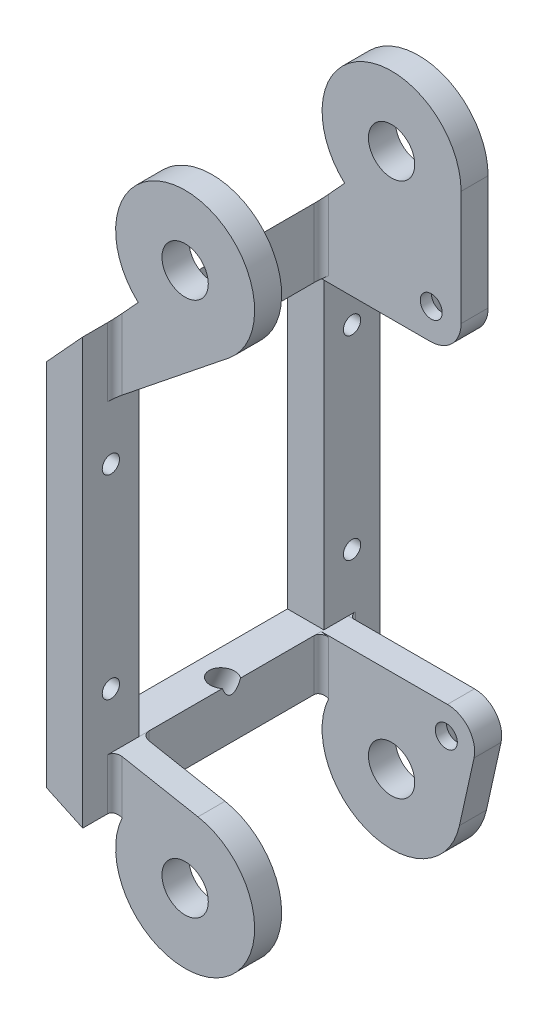
from build123d import *

# Parameters (mm, degrees)
LINK_GEOMETRY_DEPTH                            = 30.572250038
SKETCH3_R                                      = 7.14375
JOINT_ROUNDS_DEPTH                             = 30.572250038
SKETCH5_R                                      = 2.38125
JOINT_HOLES_DEPTH                              = 323.793006671
SKETCH6_W                                      = 19.2375
SKETCH6_H                                      = 31.422524012
BULK_REMOVAL_DEPTH                             = 323.793006671
SKETCH7_W                                      = 19
SKETCH7_H                                      = 31.422524012
CONTACTPAD_OPENING_DEPTH                       = 217.555615914
SKETCH9_R                                      = 7.33425
CUT_EXTRUDE4_DEPTH                             = 3.286125
SKETCH12_W                                     = 53.268009521
SKETCH12_H                                     = 61.768223806
SURFACE_REDUCTION_DEPTH                        = 1.016
F_2_56_TAPPED_HOLE1_D                          = 1.778
F_2_56_TAPPED_HOLE1_CSINK_D                    = 5
F_2_56_TAPPED_HOLE1_CSINK_ANGLE                = 82
SKETCH19_R                                     = 7.33425
CUT_EXTRUDE8_DEPTH                             = 9.221875003
SKETCH20_W                                     = 21.352711571
SKETCH20_H                                     = 18.443750006
CUT_EXTRUDE9_DEPTH                             = 252.802485903
SKETCH21_W                                     = 24.193204712
SKETCH21_H                                     = 71.241054526
CUT_EXTRUDE10_DEPTH                            = 18.427750038
SKETCH22_R                                     = 0.535
CUT_EXTRUDE12_DEPTH                            = 18.427750038
SKETCH23_R                                     = 1.25
CUT_EXTRUDE13_DEPTH                            = 18.427750038
CUT_EXTRUDE14_DEPTH                            = 323.498364807
FILLET1_R                                      = 0.75
BOSS_EXTRUDE1_REACH                            = 320.899
SKETCH28_R                                     = 1.1303
PROX_SPRING_HOLE_DEPTH                         = 2.778125016
FILLET2_R                                      = 2.8
CSK_FOR_2_FLAT_HEAD_MACHINE_SCREW1_D           = 2.2606
CSK_FOR_2_FLAT_HEAD_MACHINE_SCREW1_DEPTH       = 2.777125016
CSK_FOR_2_FLAT_HEAD_MACHINE_SCREW1_CSINK_D     = 5.0999898
CSK_FOR_2_FLAT_HEAD_MACHINE_SCREW1_CSINK_ANGLE = 82
CSK_FOR_2_FLAT_HEAD_MACHINE_SCREW1_TIP         = 0.679152758
SKETCH32_R                                     = 1.025
DISTAL_SHEATH_HOLE_DEPTH                       = 19.05
DISTAL_SHEATH_SLOT_DEPTH                       = 19.05
FILLET3_R                                      = 3.175


with BuildPart() as part:
    # Sketch2 → link_geometry (new body)
    with BuildSketch(Plane.XY):
        Polygon((240.143856424, 163.499556409), (228.143856424, 151.378124535), (216.143856424, 156.973816433), (216.143856424, 193.282422523), (228.143856424, 206.378124535), (240.143856424, 204.262200767), align=None)
    extrude(amount=LINK_GEOMETRY_DEPTH)

    # Sketch3 → joint_rounds (add)
    with BuildSketch(Plane.XY.offset(30.572250038)):
        with Locations((228.143856424, 151.378124535)):
            Circle(SKETCH3_R)
        with Locations((228.143856424, 206.378124535)):
            Circle(SKETCH3_R)
    extrude(amount=-JOINT_ROUNDS_DEPTH)

    # Sketch5 → joint_holes (cut, through all)
    with BuildSketch(Plane.XY.offset(30.572250038)):
        with Locations((228.143856424, 206.378124535)):
            Circle(SKETCH5_R)
        with Locations((228.143856424, 151.378124535)):
            Circle(SKETCH5_R)
    extrude(amount=-JOINT_HOLES_DEPTH, mode=Mode.SUBTRACT)

    # Sketch6 → bulk_removal (cut, through all)
    with BuildSketch(Plane.XY.offset(30.572250038)):
        with Locations((230.525106424, 175.719125556)):
            Rectangle(SKETCH6_W, SKETCH6_H)
    extrude(amount=-BULK_REMOVAL_DEPTH, mode=Mode.SUBTRACT)

    # Sketch7 → contactpad_opening (cut, through all)
    with BuildSketch(Plane(origin=(220.906356424, 0, 0), x_dir=(0, 0, -1), z_dir=(1, 0, 0))):
        with Locations((-15.286125019, 175.719125556)):
            Rectangle(SKETCH7_W, SKETCH7_H)
    extrude(amount=-CONTACTPAD_OPENING_DEPTH, mode=Mode.SUBTRACT)

    # Sketch9 → Cut-Extrude4 (cut)
    with BuildSketch(Plane.XY.offset(30.572250038)):
        with Locations((228.143856424, 151.378124535)):
            Circle(SKETCH9_R)
        with Locations((228.143856424, 206.378124535)):
            Circle(SKETCH9_R)
    cut_extrude4 = extrude(amount=-CUT_EXTRUDE4_DEPTH, mode=Mode.SUBTRACT)

    # Sketch12 → surface_reduction (cut)
    with BuildSketch(Plane.ZY.offset(-216.143856424)):
        with Locations((15.227490437, 176.668068821)):
            Rectangle(SKETCH12_W, SKETCH12_H)
    extrude(amount=-SURFACE_REDUCTION_DEPTH, mode=Mode.SUBTRACT)

    # #2-56 Tapped Hole1 (through all)
    with Locations(Plane.ZY.offset(-217.159856424)):
        with Locations((2.893062509, 185.719125556), (2.893062509, 165.719125556), (27.679187528, 165.719125556), (27.679187528, 185.719125556)):
            CounterSinkHole(F_2_56_TAPPED_HOLE1_D / 2, F_2_56_TAPPED_HOLE1_CSINK_D / 2, counter_sink_angle=F_2_56_TAPPED_HOLE1_CSINK_ANGLE)

    # Sketch19 → Cut-Extrude8 (cut, symmetric)
    with BuildSketch(Plane.XY.offset(15.286125019)):
        with Locations((228.143856424, 206.378124535)):
            Circle(SKETCH19_R)
        with Locations((228.143856424, 151.378124535)):
            Circle(SKETCH19_R)
    extrude(amount=CUT_EXTRUDE8_DEPTH, both=True, mode=Mode.SUBTRACT)

    # Sketch20 → Cut-Extrude9 (cut, through all)
    with BuildSketch(Plane(origin=(0, 144.234374535, 0), x_dir=(-1, 0, 0), z_dir=(0, -1, 0))):
        with Locations((-231.58271221, -15.286125019)):
            Rectangle(SKETCH20_W, SKETCH20_H)
    extrude(amount=-CUT_EXTRUDE9_DEPTH, mode=Mode.SUBTRACT)

    # Sketch21 → Cut-Extrude10 (cut)
    with BuildSketch(Plane.XY.offset(27.286125038)):
        with Locations((233.00295878, 180.513642368)):
            Rectangle(SKETCH21_W, SKETCH21_H)
    cut_extrude10 = extrude(amount=CUT_EXTRUDE10_DEPTH, mode=Mode.SUBTRACT)

    # Mirror1: Cut-Extrude10 across plane
    add(cut_extrude10.mirror(Plane.XY.offset(15.286125019)), mode=Mode.SUBTRACT)

    # Mirror2: Cut-Extrude4 across plane
    add(cut_extrude4.mirror(Plane.XY.offset(15.286125019)), mode=Mode.SUBTRACT)

    # Sketch22 → Cut-Extrude12 (cut)
    with BuildSketch(Plane(origin=(98.729091699, 211.725220405, 0), x_dir=(0.906307787036652, -0.42261826174069506, 0), z_dir=(-0.42261826174069506, -0.906307787036652, 0))):
        with Locations((131.760393785, 15.286125019)):
            Circle(SKETCH22_R)
    extrude(amount=-CUT_EXTRUDE12_DEPTH, mode=Mode.SUBTRACT)

    # Sketch23 → Cut-Extrude13 (cut)
    with BuildSketch(Plane(origin=(99.39999819, 213.163984017, 0), x_dir=(0.906307787036652, -0.42261826174069506, 0), z_dir=(0.42261826174069506, 0.906307787036652, 0))):
        with Locations(Location((131.760393785, -15.286125019, 0), (0, 0, 48.607805398))):
            Circle(SKETCH23_R)
    extrude(amount=CUT_EXTRUDE13_DEPTH, mode=Mode.SUBTRACT)

    # Sketch25 → Cut-Extrude14 (cut, through all)
    with BuildSketch(Plane(origin=(0, 0, 3.286125), x_dir=(-1, 0, 0), z_dir=(0, 0, -1))):
        with BuildLine():
            Line((-220.906356424, 160.00786355), (-229.4639099, 158.398852623))
            ThreePointArc((-229.4639099, 158.398852623), (-231.462370725, 157.704310345), (-233.169757129, 156.454883952))
            Line((-233.169757129, 156.454883952), (-246.03003643, 156.454883952))
            Line((-246.03003643, 156.454883952), (-246.03003643, 205.137625366))
            Line((-246.03003643, 205.137625366), (-235.17907681, 205.137625366))
            ThreePointArc((-235.17907681, 205.137625366), (-234.289208718, 202.735624123), (-232.609215668, 200.801949243))
            Line((-232.609215668, 200.801949243), (-220.906356424, 191.430387562))
            Line((-220.906356424, 191.430387562), (-220.906356424, 160.00786355))
        make_face()
    extrude(amount=-CUT_EXTRUDE14_DEPTH, mode=Mode.SUBTRACT)

    # Fillet1
    fillet1_edges = [part.edges().sort_by_distance(p)[0] for p in [
        (220.906356424, 157.380444881, 6.064250016),
        (220.906356424, 194.955083411, 6.064250016),
        (220.906356424, 157.380444881, 24.508000022),
        (220.906356424, 194.955083411, 24.508000022),
        (220.906356424, 194.955083411, 27.286125038),
        (220.906356424, 157.380444881, 27.286125038),
        (220.906356424, 157.380444881, 3.286125),
        (220.906356424, 194.955083411, 3.286125),
    ]]
    fillet(fillet1_edges, radius=FILLET1_R)

    # Boss-Extrude1: up to this face of the body (flat: up to its plane)
    boss_extrude1_end = Plane(part.part.faces().sort_by_distance((221.752390309, 154.592187289, 6.064250016))[0])
    # Sketch26 → Boss-Extrude1 (add, up to the picked face)
    with BuildSketch(Plane(origin=(0, 0, 3.286125), x_dir=(-1, 0, 0), z_dir=(0, 0, -1)), mode=Mode.PRIVATE) as boss_extrude1_sk1:
        with BuildLine():
            Line((-220.906356424, 160.00786355), (-235.287606424, 160.00786355))
            Line((-235.287606424, 160.00786355), (-237.374220284, 160.00786355))
            Line((-237.374220284, 160.00786355), (-235.118271025, 149.831934043))
            ThreePointArc((-235.118271025, 149.831934043), (-234.106035024, 155.313298027), (-229.4639099, 158.398852623))
            Line((-229.4639099, 158.398852623), (-220.906356424, 160.00786355))
        make_face()
    boss_extrude1_tool1 = split(extrude(boss_extrude1_sk1.sketch, amount=-BOSS_EXTRUDE1_REACH, mode=Mode.PRIVATE), bisect_by=boss_extrude1_end, keep=Keep.BOTH, mode=Mode.PRIVATE)
    # Sketch26 → Boss-Extrude1 (add, up to the picked face)
    with BuildSketch(Plane(origin=(0, 0, 3.286125), x_dir=(-1, 0, 0), z_dir=(0, 0, -1)), mode=Mode.PRIVATE) as boss_extrude1_sk2:
        with BuildLine():
            Line((-220.906356424, 191.430387562), (-232.609215668, 200.801949243))
            ThreePointArc((-232.609215668, 200.801949243), (-234.583247525, 203.285002115), (-235.287606422, 206.377934686))
            Line((-235.287606422, 206.377934686), (-235.287209171, 191.430005382))
            Line((-235.287209171, 191.430005382), (-220.906356424, 191.430387562))
        make_face()
    boss_extrude1_tool2 = split(extrude(boss_extrude1_sk2.sketch, amount=-BOSS_EXTRUDE1_REACH, mode=Mode.PRIVATE), bisect_by=boss_extrude1_end, keep=Keep.BOTH, mode=Mode.PRIVATE)
    add(boss_extrude1_tool1.solids().sort_by(Axis((232.662189, 157.945837, 3.286125), (0, 0, 1)))[0])
    add(boss_extrude1_tool2.solids().sort_by(Axis((230.577028, 195.425201, 3.286125), (0, 0, 1)))[0])

    # Sketch28 → prox_spring_hole (cut)
    with BuildSketch(Plane(origin=(0, 0, 3.286125), x_dir=(-1, 0, 0), z_dir=(0, 0, -1))):
        with Locations((-233.769956424, 157.128124535)):
            Circle(SKETCH28_R)
        with Locations((-232.220400769, 194.605086885)):
            Circle(SKETCH28_R)
    extrude(amount=-PROX_SPRING_HOLE_DEPTH, mode=Mode.SUBTRACT)

    # Fillet2
    fillet2_edges = [part.edges().sort_by_distance(p)[0] for p in [
        (237.374220284, 160.00786355, 4.675187508),
    ]]
    fillet(fillet2_edges, radius=FILLET2_R)

    # CSK for #2 Flat Head Machine Screw1
    with Locations(Plane(origin=(0, 0, 3.286125), x_dir=(-1, 0, 0), z_dir=(0, 0, -1))):
        with Locations((-233.769956424, 157.128124535), (-232.220400769, 194.605086885)):
            CounterSinkHole(CSK_FOR_2_FLAT_HEAD_MACHINE_SCREW1_D / 2, CSK_FOR_2_FLAT_HEAD_MACHINE_SCREW1_CSINK_D / 2, depth=CSK_FOR_2_FLAT_HEAD_MACHINE_SCREW1_DEPTH, counter_sink_angle=CSK_FOR_2_FLAT_HEAD_MACHINE_SCREW1_CSINK_ANGLE)
            with Locations((0, 0, -(CSK_FOR_2_FLAT_HEAD_MACHINE_SCREW1_DEPTH + CSK_FOR_2_FLAT_HEAD_MACHINE_SCREW1_TIP / 2))):  # 118° drill point
                Cone(0, CSK_FOR_2_FLAT_HEAD_MACHINE_SCREW1_D / 2, CSK_FOR_2_FLAT_HEAD_MACHINE_SCREW1_TIP, mode=Mode.SUBTRACT)

    # Sketch32 → distal_sheath_hole (cut)
    with BuildSketch(Plane(origin=(22.676095468, -20.778813182, 0), x_dir=(0, 0, 1), z_dir=(-0.7372773368101212, 0.6755902076156635, 0))):
        with Locations(Location((15.286125019, 290.809071448, 0), (0, 0, 270))):
            Circle(SKETCH32_R)
    extrude(amount=-DISTAL_SHEATH_HOLE_DEPTH, mode=Mode.SUBTRACT)

    # Sketch33 → distal_sheath_slot (cut)
    with BuildSketch(Plane(origin=(22.676095468, -20.778813182, 0), x_dir=(0, 0, -1), z_dir=(0.7372773368101211, -0.6755902076156636, 0))):
        with BuildLine():
            Line((-15.936125019, 297.159071448), (-15.936125019, 284.459071448))
            ThreePointArc((-15.936125019, 284.459071448), (-15.286125019, 283.809071448), (-14.636125019, 284.459071448))
            Line((-14.636125019, 284.459071448), (-14.636125019, 297.159071448))
            ThreePointArc((-14.636125019, 297.159071448), (-15.286125019, 297.809071448), (-15.936125019, 297.159071448))
        make_face()
    extrude(amount=-DISTAL_SHEATH_SLOT_DEPTH, mode=Mode.SUBTRACT)

    # Fillet3
    fillet3_edges = [part.edges().sort_by_distance(p)[0] for p in [
        (235.287209171, 191.430005382, 4.675187508),
    ]]
    fillet(fillet3_edges, radius=FILLET3_R)


solid = part.part
